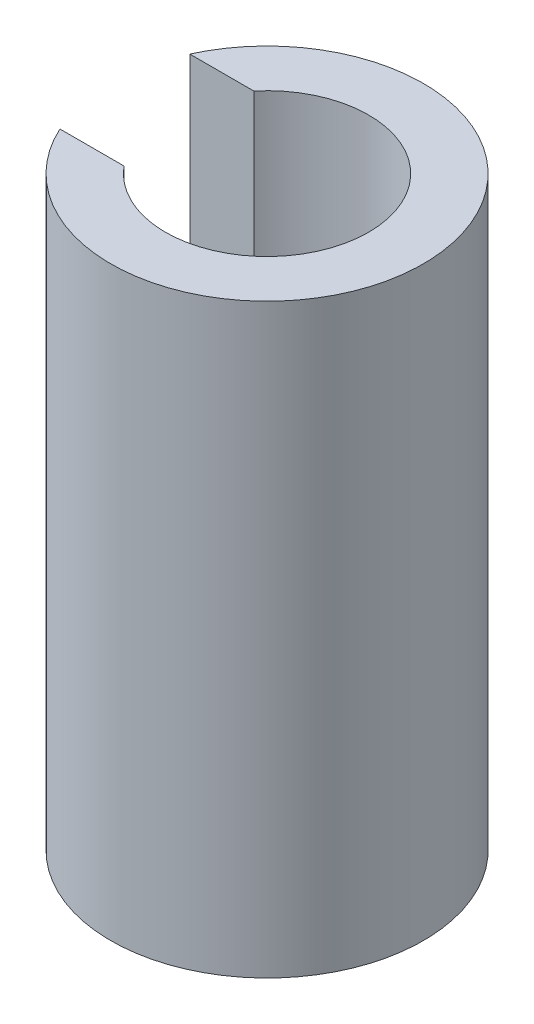
from build123d import *

# Parameters (mm, degrees)
SKETCH_1_R          = 4
SKETCH_1_R_2        = 2.6
EXTRUDE_1_DEPTH     = 15
SKETCH_2_W          = 2
SKETCH_2_H          = 3.322649546
CUT_EXTRUDE_1_DEPTH = 15


with BuildPart() as part:
    # 草圖1 → 填料-伸長1 (new body)
    with BuildSketch(Plane(origin=(0, 0, 0), x_dir=(1, 0, 0), z_dir=(0, 1, 0))):
        Circle(SKETCH_1_R)
        Circle(SKETCH_1_R_2, mode=Mode.SUBTRACT)
    extrude(amount=EXTRUDE_1_DEPTH)

    # 草圖2 → 除料-伸長1 (cut)
    with BuildSketch(Plane(origin=(0, 15, 0), x_dir=(1, 0, 0), z_dir=(0, 1, 0))):
        with Locations((-3, 0)):
            Rectangle(SKETCH_2_W, SKETCH_2_H)
    extrude(amount=-CUT_EXTRUDE_1_DEPTH, mode=Mode.SUBTRACT)


solid = part.part
